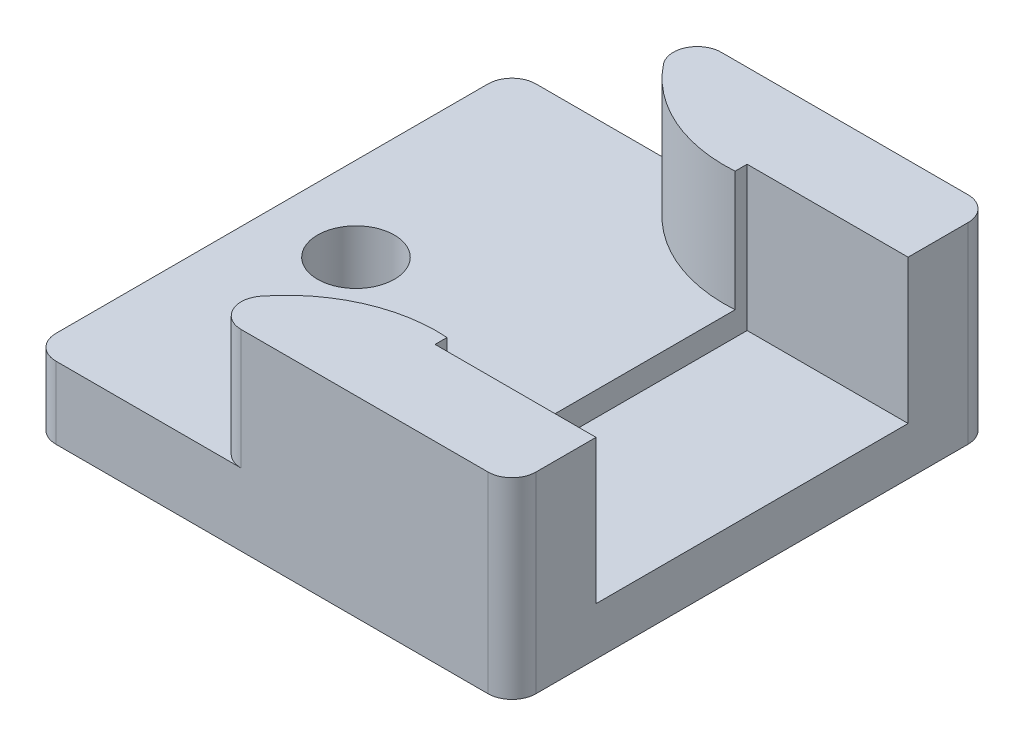
from build123d import *

# Parameters (mm, degrees)
CROQUIS2_W              = 20
CROQUIS2_H              = 20
SALIENTE_EXTRUIR1_DEPTH = 8
CROQUIS3_W              = 6.705751287
CROQUIS3_H              = 13
CORTAR_EXTRUIR1_DEPTH   = 6
CORTAR_EXTRUIR2_DEPTH   = 5
CROQUIS6_R              = 1.6
CORTAR_EXTRUIR3_DEPTH   = 3
REDONDEO1_R             = 1


with BuildPart() as part:
    # Croquis2 → Saliente-Extruir1 (new body)
    with BuildSketch(Plane(origin=(0, 0, 0), x_dir=(1, 0, 0), z_dir=(0, 1, 0))):
        with Locations((-0.843373494, -1.526104418)):
            Rectangle(CROQUIS2_W, CROQUIS2_H)
    extrude(amount=SALIENTE_EXTRUIR1_DEPTH)

    # Croquis3 → Cortar-Extruir1 (cut)
    with BuildSketch(Plane(origin=(0, 8, 0), x_dir=(1, 0, 0), z_dir=(0, 1, 0))):
        with Locations((5.803750863, -1.526104418)):
            Rectangle(CROQUIS3_W, CROQUIS3_H)
    extrude(amount=-CORTAR_EXTRUIR1_DEPTH, mode=Mode.SUBTRACT)

    # Croquis5 → Cortar-Extruir2 (cut)
    with BuildSketch(Plane(origin=(0, 8, 0), x_dir=(1, 0, 0), z_dir=(0, 1, 0))):
        with BuildLine():
            Line((2.450875219, -7.526104418), (2.450875219, 4.473895582))
            ThreePointArc((2.450875219, 4.473895582), (2.020425803, 4.459111389), (1.589976387, 4.473895582))
            ThreePointArc((1.589976387, 4.473895582), (-1.703861847, 5.684131739), (-3.832537389, 8.473895582))
            Line((-3.832537389, 8.473895582), (-10.843373494, 8.473895582))
            Line((-10.843373494, 8.473895582), (-10.843373494, -11.526104418))
            Line((-10.843373494, -11.526104418), (-3.832537389, -11.526104418))
            ThreePointArc((-3.832537389, -11.526104418), (-1.703861847, -8.736340574), (1.589976387, -7.526104418))
            ThreePointArc((1.589976387, -7.526104418), (2.020425803, -7.511320225), (2.450875219, -7.526104418))
        make_face()
    extrude(amount=-CORTAR_EXTRUIR2_DEPTH, mode=Mode.SUBTRACT)

    # Croquis6 → Cortar-Extruir3 (cut)
    with BuildSketch(Plane(origin=(0, 3, 0), x_dir=(1, 0, 0), z_dir=(0, 1, 0))):
        with Locations(Location((-7.343373494, -1.526104418, 0), (0, 0, 270))):
            Circle(CROQUIS6_R)
    extrude(amount=-CORTAR_EXTRUIR3_DEPTH, mode=Mode.SUBTRACT)

    # Redondeo1
    redondeo1_edges = [part.edges().sort_by_distance(p)[0] for p in [
        (-10.843373494, 1.5, -8.473895582),
        (-10.843373494, 1.5, 11.526104418),
        (-3.832537389, 5.5, 11.526104418),
        (-3.832537389, 5.5, -8.473895582),
        (9.156626506, 4, -8.473895582),
        (9.156626506, 4, 11.526104418),
    ]]
    fillet(redondeo1_edges, radius=REDONDEO1_R)


solid = part.part
